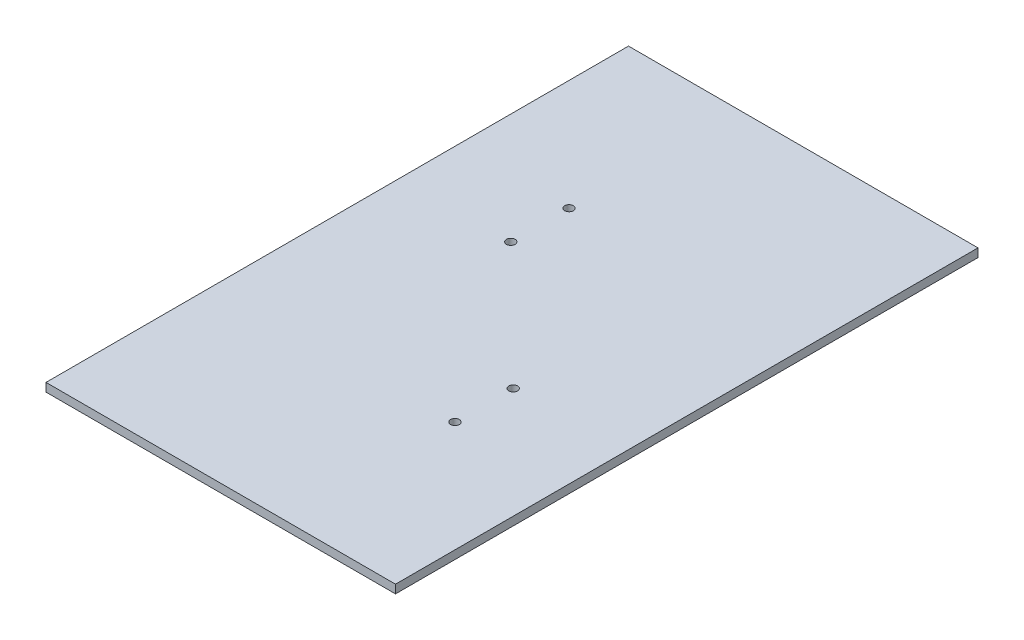
from build123d import *

# Parameters (mm, degrees)
SKETCH1_W           = 120
SKETCH1_H           = 200
SKETCH1_R           = 1.5
BOSS_EXTRUDE1_DEPTH = 1.45


with BuildPart() as part:
    # Sketch1 → Boss-Extrude1 (new, symmetric)
    with BuildSketch(Plane(origin=(0, 0, 0), x_dir=(1, 0, 0), z_dir=(0, 1, 0))):
        Rectangle(SKETCH1_W, SKETCH1_H)
        with Locations(Location((-22, 41.578386207, 0), (0, 0, 270))):
            Circle(SKETCH1_R, mode=Mode.SUBTRACT)
        with Locations(Location((-22, 21.578386207, 0), (0, 0, 270))):
            Circle(SKETCH1_R, mode=Mode.SUBTRACT)
        with Locations(Location((22, -21.578386207, 0), (0, 0, 270))):
            Circle(SKETCH1_R, mode=Mode.SUBTRACT)
        with Locations(Location((22, -41.578386207, 0), (0, 0, 270))):
            Circle(SKETCH1_R, mode=Mode.SUBTRACT)
    extrude(amount=BOSS_EXTRUDE1_DEPTH, both=True)


solid = part.part
